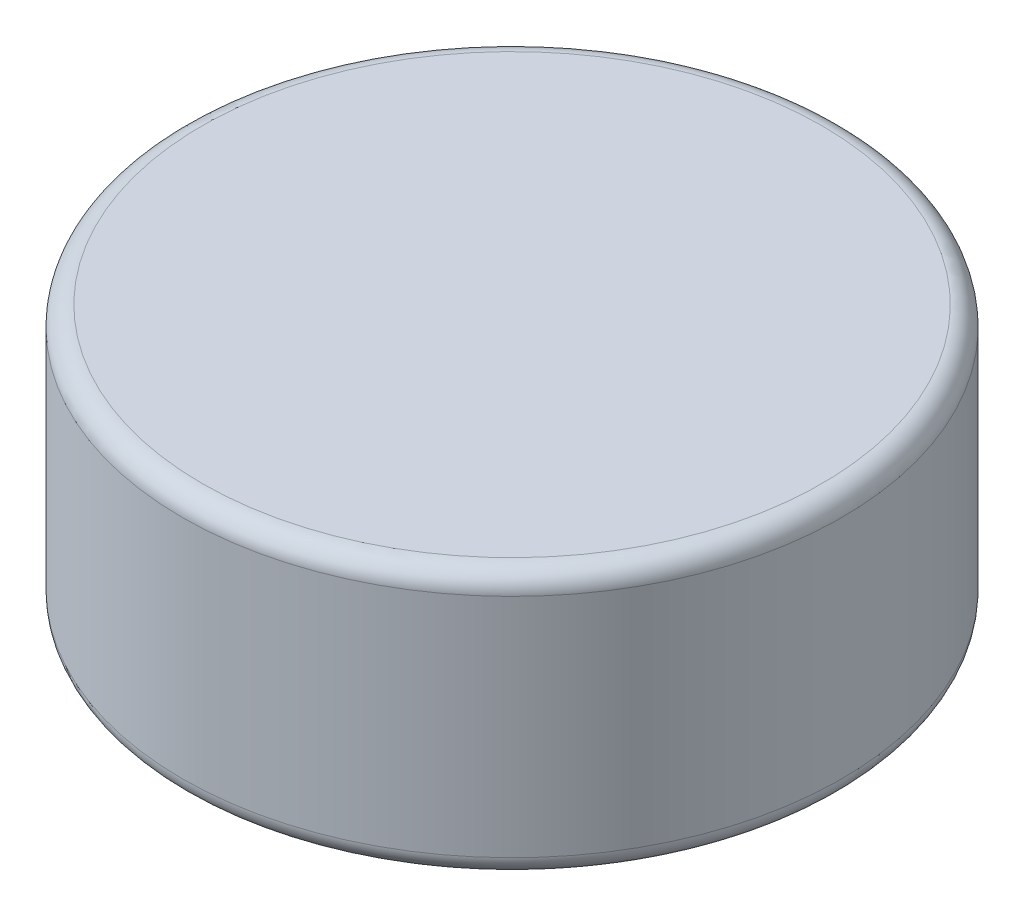
from build123d import *

# Parameters (mm, degrees)
ESBO_O1_R                = 33.5
RESSALTO_EXTRUS_O1_DEPTH = 27
FILETE1_R                = 2
ESBO_O2_R                = 5.75
RESSALTO_EXTRUS_O2_DEPTH = 2
ESBO_O3_R                = 3
CORTE_EXTRUS_O1_DEPTH    = 5


with BuildPart() as part:
    # Esboço1 → Ressalto-extrusão1 (new body)
    with BuildSketch(Plane(origin=(0, 0, 0), x_dir=(1, 0, 0), z_dir=(0, 1, 0))):
        with Locations(Location((0, 0, 0), (0, 0, 270))):
            Circle(ESBO_O1_R)
    extrude(amount=RESSALTO_EXTRUS_O1_DEPTH)

    # Filete1
    filete1_edges = [part.edges().sort_by_distance(p)[0] for p in [
        (0, 0, -33.5),
        (0, 27, -33.5),
    ]]
    fillet(filete1_edges, radius=FILETE1_R)

    # Esboço2 → Ressalto-extrusão2 (add)
    with BuildSketch(Plane(origin=(0, 0, 0), x_dir=(-1, 0, 0), z_dir=(0, -1, 0))):
        with Locations(Location((0, 0, 0), (0, 0, 270))):
            Circle(ESBO_O2_R)
    extrude(amount=RESSALTO_EXTRUS_O2_DEPTH)

    # Esboço3 → Corte-extrusão1 (cut)
    with BuildSketch(Plane.XZ.offset(2)):
        with Locations(Location((0, 0, 0), (0, 0, 270))):
            Circle(ESBO_O3_R)
    extrude(amount=-CORTE_EXTRUS_O1_DEPTH, mode=Mode.SUBTRACT)


solid = part.part
